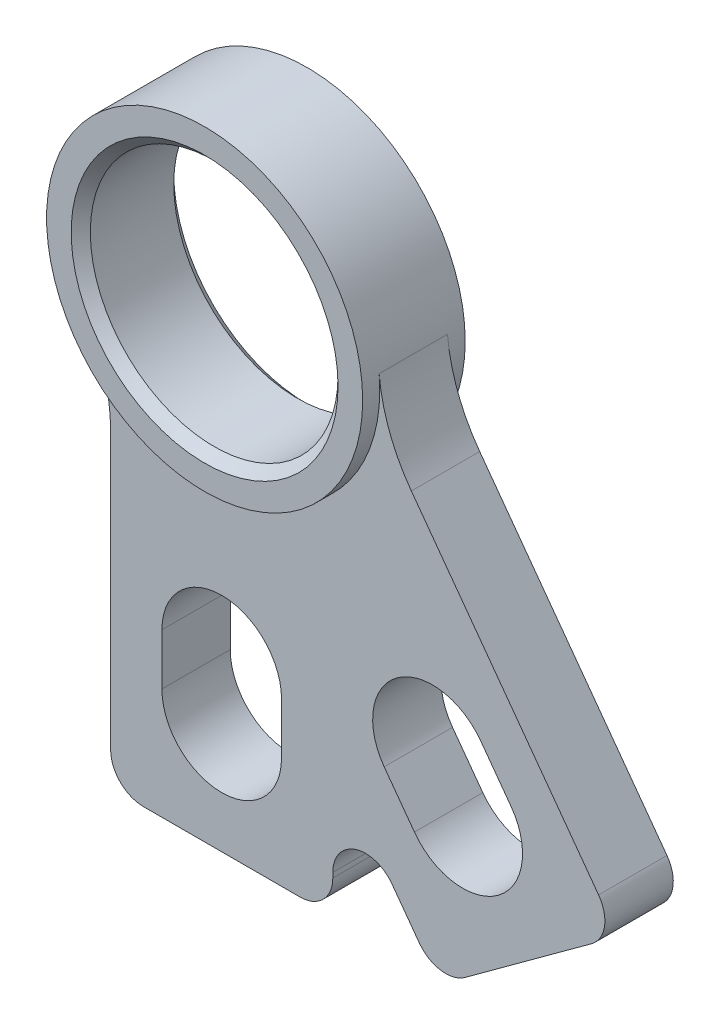
from build123d import *

# Parameters (mm, degrees)
SKETCH1_R           = 11.5062
BOSS_EXTRUDE2_DEPTH = 4.7625
BOSS_EXTRUDE3_DEPTH = 3.175
FILLET1_R           = 3.048
CHAMFER1_SIZE       = 0.889


with BuildPart() as part:
    # Sketch1 → Boss-Extrude2 (new, symmetric)
    with BuildSketch(Plane.XY):
        with BuildLine():
            ThreePointArc((14.621497696, 1.322663433), (-4.556441994, 13.956234084), (-12.585193267, -7.559797873))
            ThreePointArc((-12.585193267, -7.559797873), (4.556441994, -13.956234084), (14.621497696, 1.322663433))
        make_face()
        Circle(SKETCH1_R, mode=Mode.SUBTRACT)
    extrude(amount=BOSS_EXTRUDE2_DEPTH, both=True)

    # Sketch1<4> → Boss-Extrude3 (add, symmetric)
    with BuildSketch(Plane.XY):
        with BuildLine():
            ThreePointArc((-12.585193267, -7.559797873), (-10.89585042, -11.492870345), (-10.31875, -15.734319794))
            Line((-10.31875, -15.734319794), (-10.31875, -44.45))
            Line((-10.31875, -44.45), (10.31875, -44.45))
            Line((10.31875, -44.45), (10.31875, -31.605996662))
            Line((10.31875, -31.605996662), (20.145719857, -45.051683354))
            Line((20.145719857, -45.051683354), (36.80750102, -32.874185469))
            Line((36.80750102, -32.874185469), (17.615185966, -6.614426983))
            ThreePointArc((17.615185966, -6.614426983), (15.578373329, -2.849545496), (14.621497696, 1.322663433))
            ThreePointArc((14.621497696, 1.322663433), (4.556441994, -13.956234084), (-12.585193267, -7.559797873))
        make_face()
        with BuildLine():
            ThreePointArc((5.55625, -34.13125), (0, -39.6875), (-5.55625, -34.13125))
            Line((-5.55625, -34.13125), (-5.55625, -29.36875))
            ThreePointArc((-5.55625, -29.36875), (0, -23.8125), (5.55625, -29.36875))
            Line((5.55625, -29.36875), (5.55625, -34.13125))
        make_face(mode=Mode.SUBTRACT)
        with BuildLine():
            ThreePointArc((26.873725655, -27.353486707), (25.666418619, -35.117907989), (17.901997337, -33.910600953))
            Line((17.901997337, -33.910600953), (15.091805517, -30.065574531))
            ThreePointArc((15.091805517, -30.065574531), (16.299112553, -22.301153249), (24.063533835, -23.508460285))
            Line((24.063533835, -23.508460285), (26.873725655, -27.353486707))
        make_face(mode=Mode.SUBTRACT)
    extrude(amount=BOSS_EXTRUDE3_DEPTH, both=True)

    # Fillet1
    fillet1_edges = [part.edges().sort_by_distance(p)[0] for p in [
        (-10.31875, -44.45, 0),
        (36.80750102, -32.874185469, 0),
        (10.31875, -31.605996662, 0),
        (10.31875, -44.45, 0),
        (20.145719857, -45.051683354, 0),
    ]]
    fillet(fillet1_edges, radius=FILLET1_R)

    # Chamfer1
    chamfer1_edges = [part.edges().sort_by_distance(p)[0] for p in [
        (-11.5062, 0, -4.7625),
        (-11.5062, 0, 4.7625),
    ]]
    chamfer(chamfer1_edges, length=CHAMFER1_SIZE)


solid = part.part
